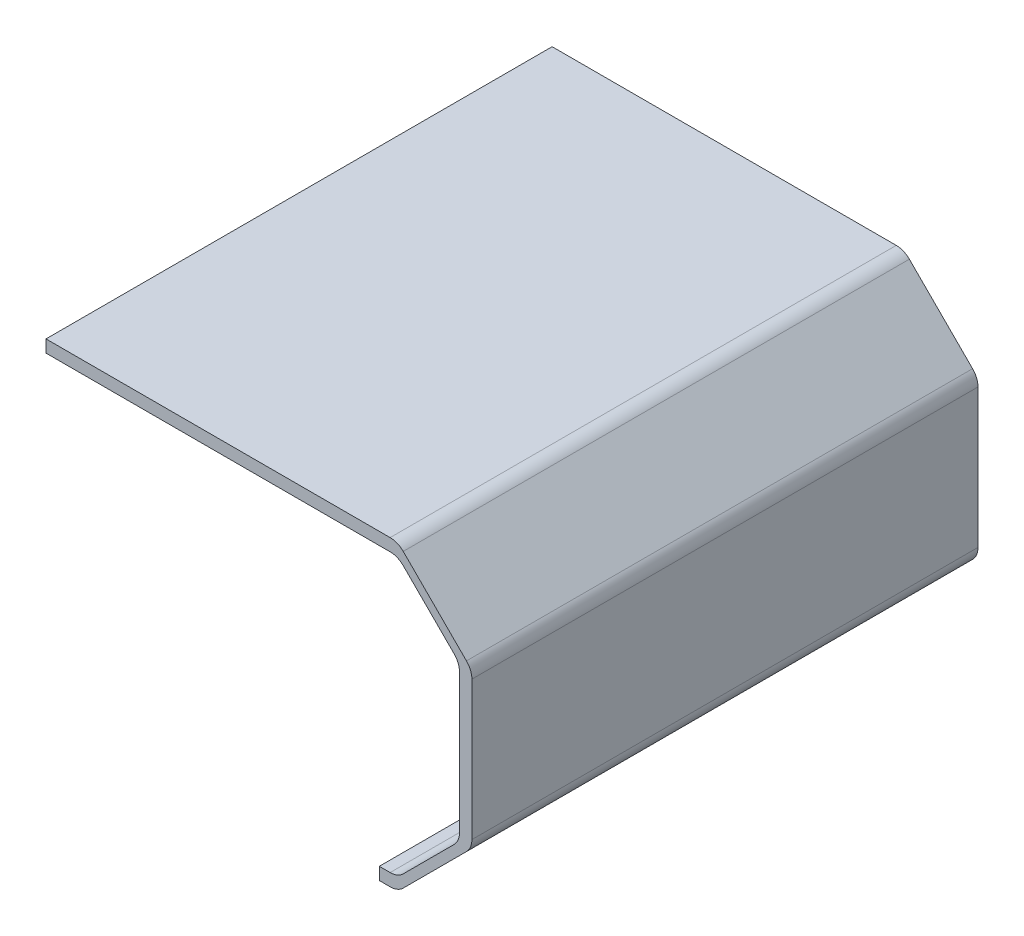
from build123d import *

# Parameters (mm, degrees)
EXTRUDE_1_DEPTH = 82
FILLET_1_R      = 3


with BuildPart() as part:
    # 草图1 → 凸台-拉伸1 (new body)
    with BuildSketch(Plane.XY):
        Polygon((0, 0), (0, 2), (3, 2), (13, 12), (13, 37), (3, 47), (-54, 47), (-54, 49), (3, 49), (15, 37), (15, 12), (3, 0), align=None)
    extrude(amount=EXTRUDE_1_DEPTH)

    # 圆角1
    fillet_1_edges = [part.edges().sort_by_distance(p)[0] for p in [
        (3, 2, 41),
        (13, 12, 41),
        (13, 37, 41),
        (3, 47, 41),
        (3, 49, 41),
        (15, 37, 41),
        (15, 12, 41),
        (3, 0, 41),
    ]]
    fillet(fillet_1_edges, radius=FILLET_1_R)


solid = part.part
